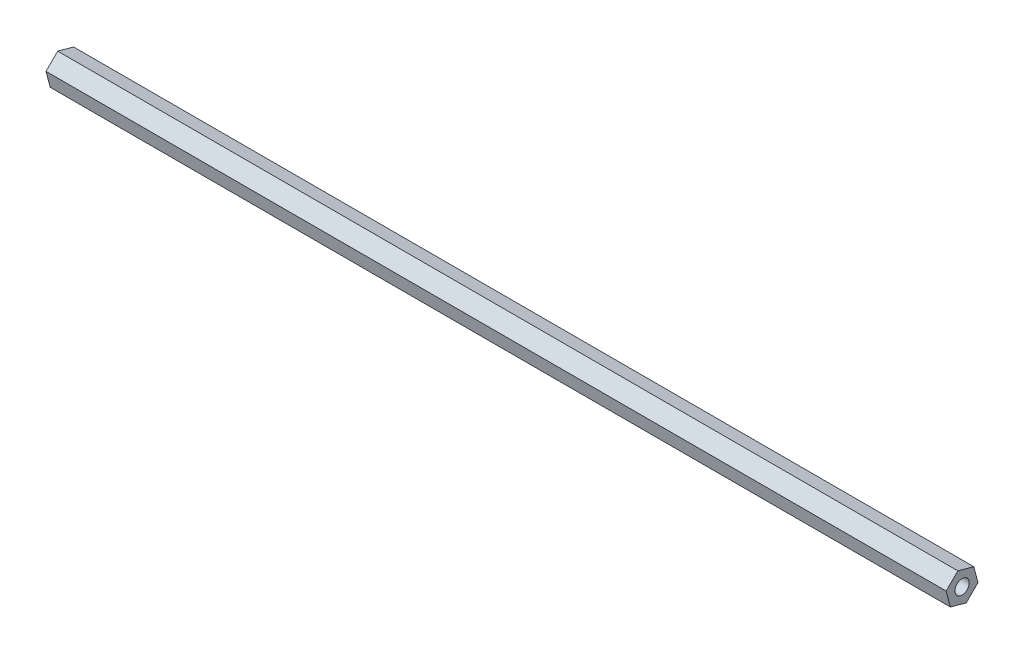
from build123d import *

# Parameters (mm, degrees)
BOSS_EXTRUDE1_DEPTH = 400.05
SKETCH2_R           = 3.175
CUT_EXTRUDE1_DEPTH  = 401.175367402


with BuildPart() as part:
    # Sketch1 → Boss-Extrude1 (new body)
    with BuildSketch(Plane(origin=(0, 0, 0), x_dir=(0, 0, -1), z_dir=(1, 0, 0))):
        Polygon((5.205999397, 5.16341976), (-1.868652984, 7.090237609), (-7.074652381, 1.92681785), (-5.205999397, -5.16341976), (1.868652984, -7.090237609), (7.074652381, -1.92681785), align=None)
    extrude(amount=BOSS_EXTRUDE1_DEPTH)

    # Sketch2 → Cut-Extrude1 (cut, through all)
    with BuildSketch(Plane(origin=(400.05, 0, 0), x_dir=(0, 0, -1), z_dir=(1, 0, 0))):
        Circle(SKETCH2_R)
    extrude(amount=-CUT_EXTRUDE1_DEPTH, mode=Mode.SUBTRACT)


solid = part.part
